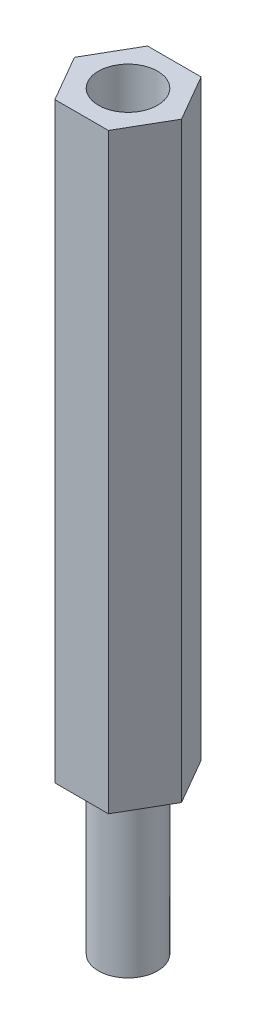
from build123d import *

# Parameters (mm, degrees)
SKETCH_1_R      = 1.5
EXTRUDE_1_DEPTH = 30
SKETCH_2_R      = 1.5
EXTRUDE_2_DEPTH = 8


with BuildPart() as part:
    # 草图1 → 凸台-拉伸1 (new body)
    with BuildSketch(Plane(origin=(0, 0, 0), x_dir=(1, 0, 0), z_dir=(0, 1, 0))):
        Polygon((2.713546265, 0), (1.356773133, 2.35), (-1.356773133, 2.35), (-2.713546265, 0), (-1.356773133, -2.35), (1.356773133, -2.35), align=None)
        with Locations(Location((0, 0, 0), (0, 0, 270))):
            Circle(SKETCH_1_R, mode=Mode.SUBTRACT)
    extrude(amount=EXTRUDE_1_DEPTH)


with BuildPart() as body_2:
    # 草图2 → 凸台-拉伸2 (new body)
    with BuildSketch(Plane(origin=(0, 0, 0), x_dir=(-1, 0, 0), z_dir=(0, -1, 0))):
        with Locations(Location((0, 0, 0), (0, 0, 90))):
            Circle(SKETCH_2_R)
    extrude(amount=EXTRUDE_2_DEPTH)


solid = Compound([part.part, body_2.part])
